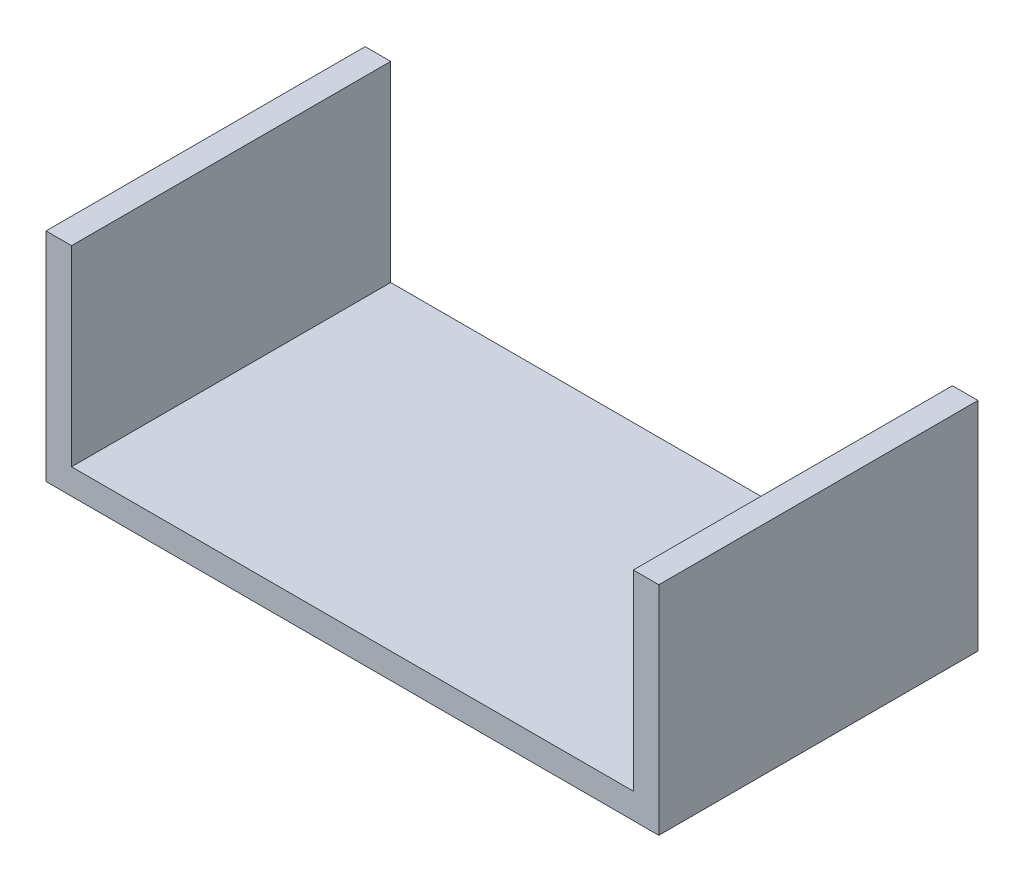
from build123d import *

# Parameters (mm, degrees)
ESBO_O1_W                = 48
ESBO_O1_H                = 25
RESSALTO_EXTRUS_O1_DEPTH = 8.5
CASCA1_T                 = -2


with BuildPart() as part:
    # Esboço1 → Ressalto-extrusão1 (new, symmetric)
    with BuildSketch(Plane(origin=(0, 0, 0), x_dir=(1, 0, 0), z_dir=(0, 1, 0))):
        Rectangle(ESBO_O1_W, ESBO_O1_H)
    extrude(amount=RESSALTO_EXTRUS_O1_DEPTH, both=True)

    # Casca1
    casca1_openings = [part.faces().sort_by_distance(p)[0] for p in [
        (0, 8.5, 0),
        (0, 0, 12.5),
        (0, 0, -12.5),
    ]]
    offset(amount=CASCA1_T, openings=casca1_openings, kind=Kind.INTERSECTION)


solid = part.part
